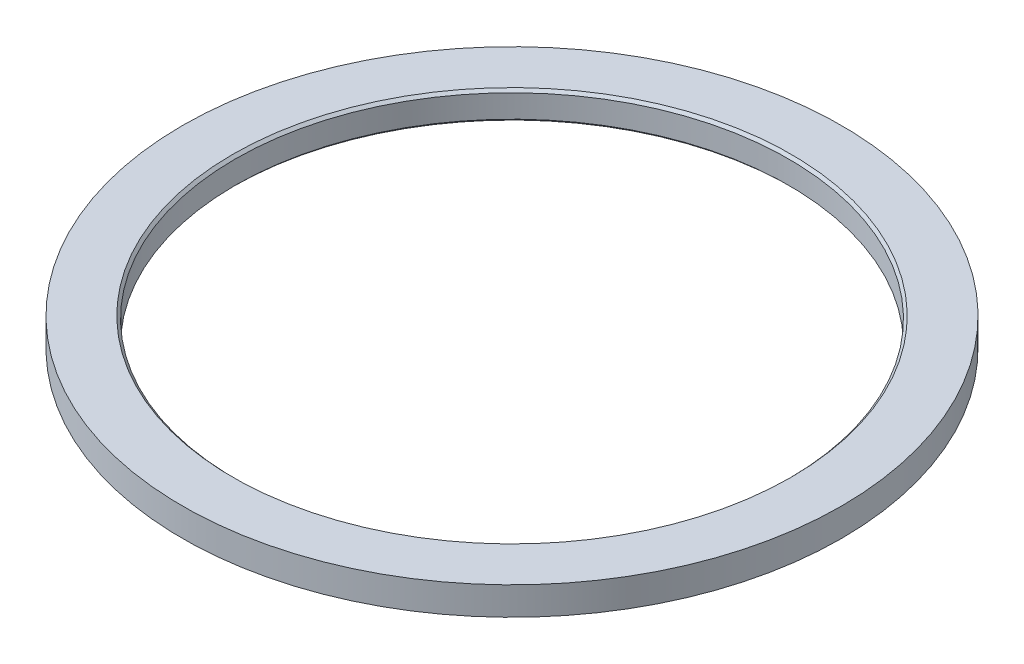
from build123d import *


with BuildPart() as part:
    # Sketch1 → Revolve1 (revolve)
    with BuildSketch(Plane.XY):
        Polygon((37.5, 3.2), (31.8, 3.2), (31.5, 2.9), (31.5, 0.3), (31.8, 0), (37.5, 0), align=None)
    revolve(axis=Axis((0, 3.2, 0), (0, -1, 0)))


solid = part.part
